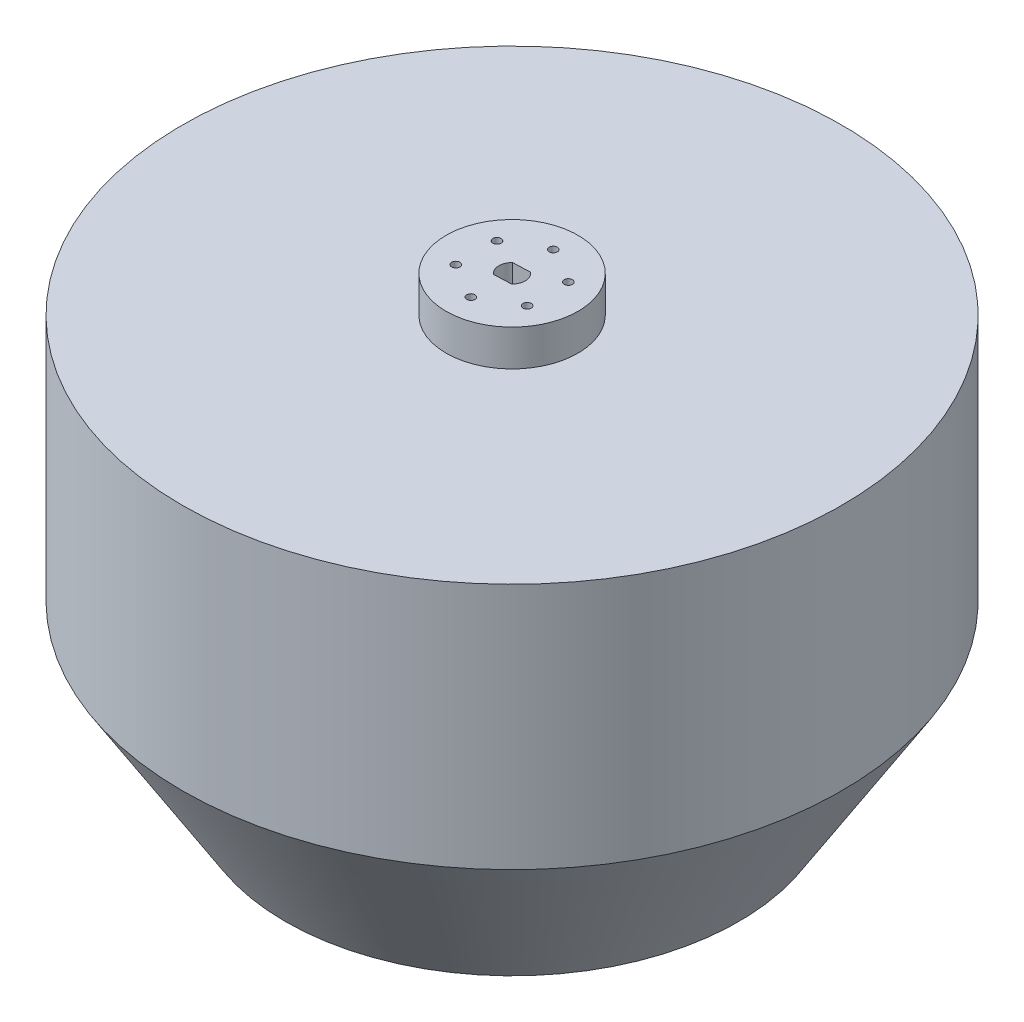
from build123d import *

# Parameters (mm, degrees)
SKETCH3_R           = 12.5
SKETCH4_R           = 12.5
SKETCH5_R           = 40
BOSS_EXTRUDE1_DEPTH = 22
SKETCH6_R           = 2.5
CUT_EXTRUDE1_DEPTH  = 15


with BuildPart() as part:
    # Sketch2 → Revolve1 (revolve)
    with BuildSketch(Plane.XY, mode=Mode.PRIVATE) as revolve1_sk:
        Polygon((0, 45.229492814), (-200, 45.229492814), (-200, -104.770507186), (-137.5, -204.770507186), (-117.5, -204.770507186), (-180, -104.770507186), (-180, 25.229492814), (-97.5, 25.229492814), (-97.5, -104.770507186), (-35, -204.770507186), (0, -204.770507186), (0, 25.229492814), align=None)
    revolve(revolve1_sk.sketch.rotate(Axis((0, 57.349299688, 0), (0, -1, 0)), 270), axis=Axis((0, 57.349299688, 0), (0, -1, 0)))

    # Sketch3 → Cut-Revolve1 (revolve, cut)
    with BuildSketch(Plane.XY, mode=Mode.PRIVATE) as cut_revolve1_sk:
        with Locations((-107.86084091, 4.25029405)):
            Circle(SKETCH3_R)
        with Locations((-107.86084091, -9.735838459)):
            Circle(SKETCH3_R)
        with Locations((-107.86084091, -23.721970968)):
            Circle(SKETCH3_R)
        with Locations((-107.86084091, -37.708103477)):
            Circle(SKETCH3_R)
        with Locations((-107.86084091, -51.694235986)):
            Circle(SKETCH3_R)
        with Locations((-107.86084091, -65.680368495)):
            Circle(SKETCH3_R)
        with Locations((-107.86084091, -79.666501004)):
            Circle(SKETCH3_R)
        with Locations((-107.86084091, -93.652633513)):
            Circle(SKETCH3_R)
    revolve(cut_revolve1_sk.sketch.rotate(Axis((0, 80.728496273, 0), (0, -1, 0)), 270), axis=Axis((0, 80.728496273, 0), (0, -1, 0)), mode=Mode.SUBTRACT)

    # Sketch4 → Cut-Revolve2 (revolve, cut)
    with BuildSketch(Plane.XY, mode=Mode.PRIVATE) as cut_revolve2_sk:
        with Locations((-89.441475281, -133.126338415)):
            Circle(SKETCH4_R)
        with Locations((-99.446691515, -117.117992442)):
            Circle(SKETCH4_R)
        with Locations((-79.436259048, -149.134684389)):
            Circle(SKETCH4_R)
        with Locations((-69.431042815, -165.143030362)):
            Circle(SKETCH4_R)
        with Locations((-59.425826582, -181.151376335)):
            Circle(SKETCH4_R)
        with Locations((-49.420610349, -197.159722308)):
            Circle(SKETCH4_R)
    revolve(cut_revolve2_sk.sketch.rotate(Axis((0, 86.064622477, 0), (0, -1, 0)), 270), axis=Axis((0, 86.064622477, 0), (0, -1, 0)), mode=Mode.SUBTRACT)

    # Sketch5 → Boss-Extrude1 (add)
    with BuildSketch(Plane(origin=(0, 45.229492814, 0), x_dir=(1, 0, 0), z_dir=(0, 1, 0))):
        with Locations(Location((0, 0, 0), (0, 0, 270))):
            Circle(SKETCH5_R)
        with BuildLine():
            Line((-5.522648203, 5.787949277), (5.05222187, 6.202826306))
            ThreePointArc((5.05222187, 6.202826306), (7.993850388, 0.313617555), (5.522648203, -5.787949277))
            Line((5.522648203, -5.787949277), (-5.05222187, -6.202826306))
            ThreePointArc((-5.05222187, -6.202826306), (-7.993850388, -0.313617555), (-5.522648203, 5.787949277))
        make_face(mode=Mode.SUBTRACT)
    extrude(amount=BOSS_EXTRUDE1_DEPTH)

    # Sketch6 → Cut-Extrude1 (cut)
    with BuildSketch(Plane(origin=(0, 67.229492814, 0), x_dir=(1, 0, 0), z_dir=(0, 1, 0))):
        with Locations(Location((0, 25, 0), (0, 0, 270))):
            Circle(SKETCH6_R)
        with Locations(Location((21.650635095, 12.5, 0), (0, 0, 270))):
            Circle(SKETCH6_R)
        with Locations(Location((21.650635095, -12.5, 0), (0, 0, 270))):
            Circle(SKETCH6_R)
        with Locations(Location((0, -25, 0), (0, 0, 270))):
            Circle(SKETCH6_R)
        with Locations(Location((-21.650635095, -12.5, 0), (0, 0, 270))):
            Circle(SKETCH6_R)
        with Locations(Location((-21.650635095, 12.5, 0), (0, 0, 270))):
            Circle(SKETCH6_R)
    extrude(amount=-CUT_EXTRUDE1_DEPTH, mode=Mode.SUBTRACT)


solid = part.part
